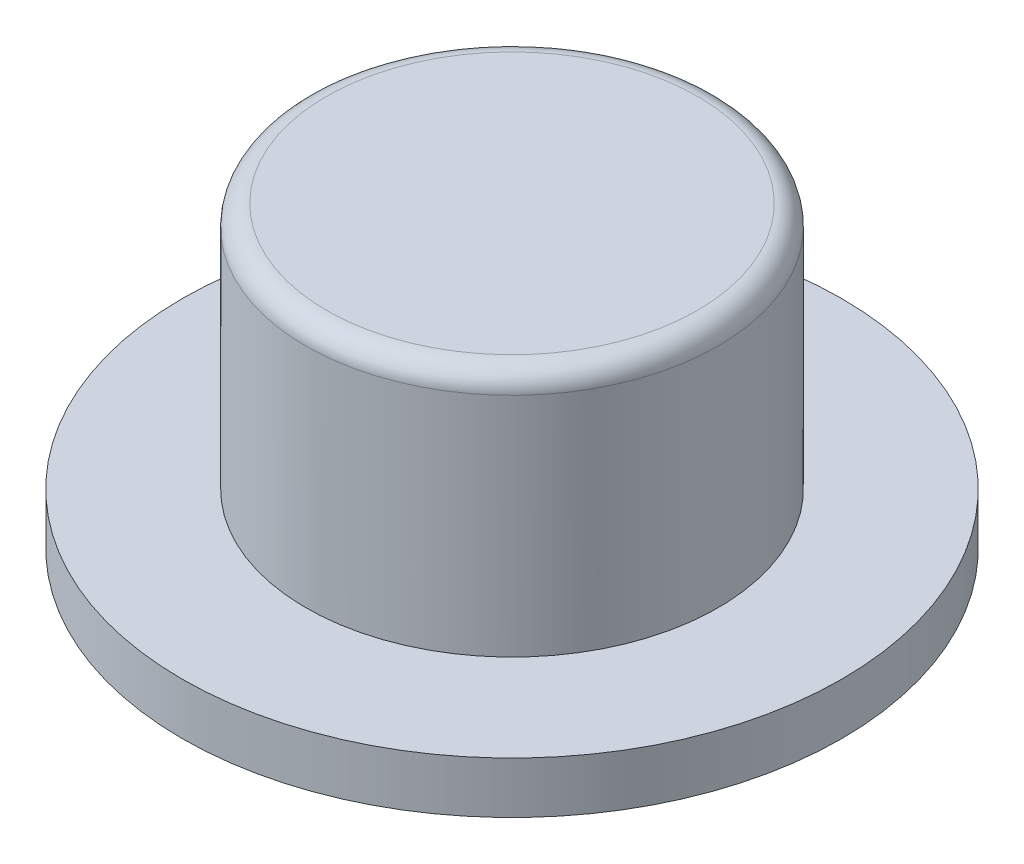
from build123d import *

# Parameters (mm, degrees)
SKETCH2_W          = 2.5
SKETCH2_H          = 3.5
CUT_EXTRUDE1_DEPTH = 3.5
FILLET1_R          = 0.5


with BuildPart() as part:
    # Sketch1 → Revolve1 (revolve)
    with BuildSketch(Plane.XY, mode=Mode.PRIVATE) as revolve1_sk:
        Polygon((0, 7.25), (5, 7.25), (5, 1.25), (8, 1.25), (8, 0), (0, 0), align=None)
    revolve(revolve1_sk.sketch.rotate(Axis((0, 7.25, 0), (0, -1, 0)), 180), axis=Axis((0, 7.25, 0), (0, -1, 0)))

    # Sketch2 → Cut-Extrude1 (cut)
    with BuildSketch(Plane.XZ):
        Rectangle(SKETCH2_W, SKETCH2_H)
    extrude(amount=-CUT_EXTRUDE1_DEPTH, mode=Mode.SUBTRACT)

    # Fillet1
    fillet1_edges = [part.edges().sort_by_distance(p)[0] for p in [
        (5, 7.25, 0),
    ]]
    fillet(fillet1_edges, radius=FILLET1_R)


solid = part.part
